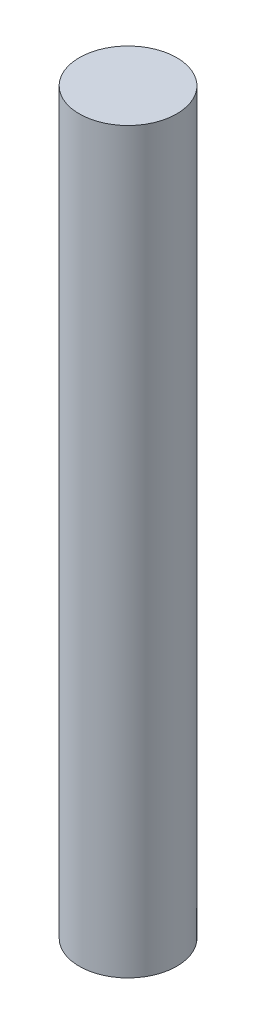
from build123d import *

# Parameters (mm, degrees)
SKETCH1_R           = 3.175
BOSS_EXTRUDE1_DEPTH = 48.1


with BuildPart() as part:
    # Sketch1 → Boss-Extrude1 (new body)
    with BuildSketch(Plane(origin=(0, 0, 0), x_dir=(1, 0, 0), z_dir=(0, 1, 0))):
        with Locations(Location((0, 0, 0), (0, 0, 90))):
            Circle(SKETCH1_R)
    extrude(amount=BOSS_EXTRUDE1_DEPTH)


solid = part.part
